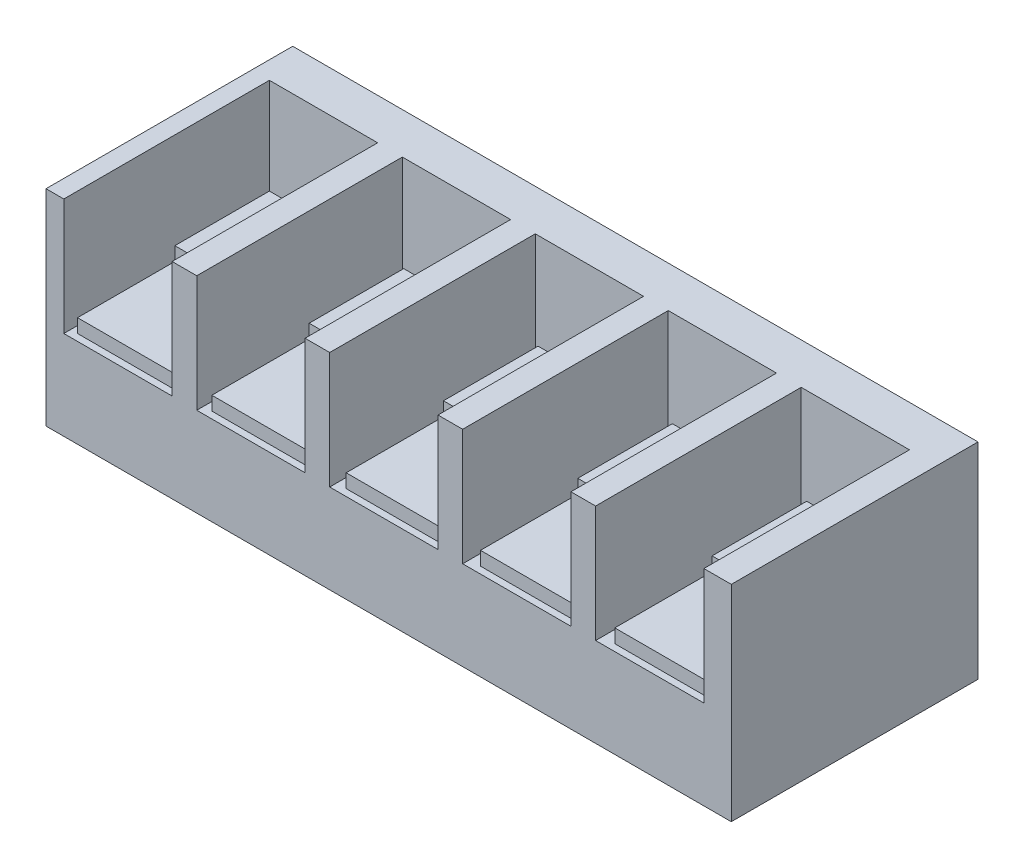
from build123d import *

# Parameters (mm, degrees)
SKETCH1_W           = 50
SKETCH1_H           = 18
BOSS_EXTRUDE1_DEPTH = 15
SKETCH2_W           = 7.9
SKETCH2_H           = 8.5
CUT_EXTRUDE1_DEPTH  = 15
SKETCH3_W           = 47
SKETCH3_H           = 15
CUT_EXTRUDE2_DEPTH  = 4
SKETCH4_W           = 6.9
SKETCH4_H           = 14
SKETCH4_R           = 1.5
BOSS_EXTRUDE2_DEPTH = 1
LPATTERN1_COUNT     = 5
LPATTERN1_PITCH     = 9.8
SKETCH5_W           = 6.9
SKETCH5_H           = 6.9
SKETCH5_R           = 1.5
BOSS_EXTRUDE3_DEPTH = 1
LPATTERN2_COUNT     = 5
LPATTERN2_PITCH     = 9.8


with BuildPart() as part:
    # Sketch1 → Boss-Extrude1 (new body)
    with BuildSketch(Plane(origin=(0, 0, 0), x_dir=(1, 0, 0), z_dir=(0, 1, 0))):
        Rectangle(SKETCH1_W, SKETCH1_H)
    extrude(amount=BOSS_EXTRUDE1_DEPTH)

    # Sketch2 → Cut-Extrude1 (cut)
    with BuildSketch(Plane.XY.offset(9)):
        with Locations((-19.75, 10.75)):
            Rectangle(SKETCH2_W, SKETCH2_H)
        with Locations((-10.05, 10.75)):
            Rectangle(SKETCH2_W, SKETCH2_H)
        with Locations((-0.35, 10.75)):
            Rectangle(SKETCH2_W, SKETCH2_H)
        with Locations((9.35, 10.75)):
            Rectangle(SKETCH2_W, SKETCH2_H)
        with Locations((19.05, 10.75)):
            Rectangle(SKETCH2_W, SKETCH2_H)
    extrude(amount=-CUT_EXTRUDE1_DEPTH, mode=Mode.SUBTRACT)

    # Sketch3 → Cut-Extrude2 (cut)
    with BuildSketch(Plane.XZ):
        Rectangle(SKETCH3_W, SKETCH3_H)
    extrude(amount=-CUT_EXTRUDE2_DEPTH, mode=Mode.SUBTRACT)

    # Sketch4 → Boss-Extrude2 (add)
    with BuildSketch(Plane(origin=(0, 6.5, 0), x_dir=(1, 0, 0), z_dir=(0, 1, 0))):
        with Locations((-19.75, -1.5)):
            Rectangle(SKETCH4_W, SKETCH4_H)
        with Locations(Location((-19.75, 2.05, 0), (0, 0, 180))):
            Circle(SKETCH4_R, mode=Mode.SUBTRACT)
    boss_extrude2 = extrude(amount=BOSS_EXTRUDE2_DEPTH)

    # LPattern1: Boss-Extrude2 ×5
    with Locations(*[(i * LPATTERN1_PITCH, 0, 0) for i in range(1, LPATTERN1_COUNT)]):
        add(boss_extrude2)

    # Sketch5 → Boss-Extrude3 (add)
    with BuildSketch(Plane(origin=(0, 7.5, 0), x_dir=(1, 0, 0), z_dir=(0, 1, 0))):
        with Locations((-19.75, 2.05)):
            Rectangle(SKETCH5_W, SKETCH5_H)
        with Locations(Location((-19.75, 2.05, 0), (0, 0, 180))):
            Circle(SKETCH5_R, mode=Mode.SUBTRACT)
    boss_extrude3 = extrude(amount=BOSS_EXTRUDE3_DEPTH)

    # LPattern2: Boss-Extrude3 ×5
    with Locations(*[(i * LPATTERN2_PITCH, 0, 0) for i in range(1, LPATTERN2_COUNT)]):
        add(boss_extrude3)


solid = part.part
